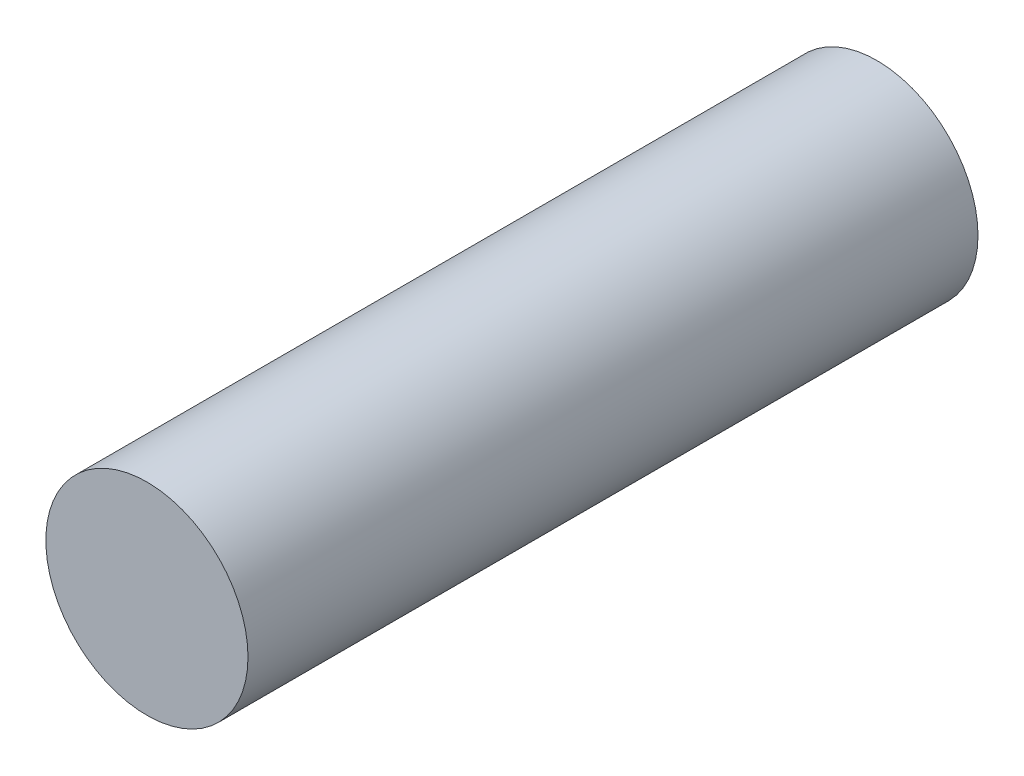
from build123d import *

# Parameters (mm, degrees)
ESQUISSE1_R        = 9
BOSS_EXTRU_1_DEPTH = 65


with BuildPart() as part:
    # Esquisse1 → Boss.-Extru.1 (new body)
    with BuildSketch(Plane.XY):
        Circle(ESQUISSE1_R)
    extrude(amount=BOSS_EXTRU_1_DEPTH)


solid = part.part
